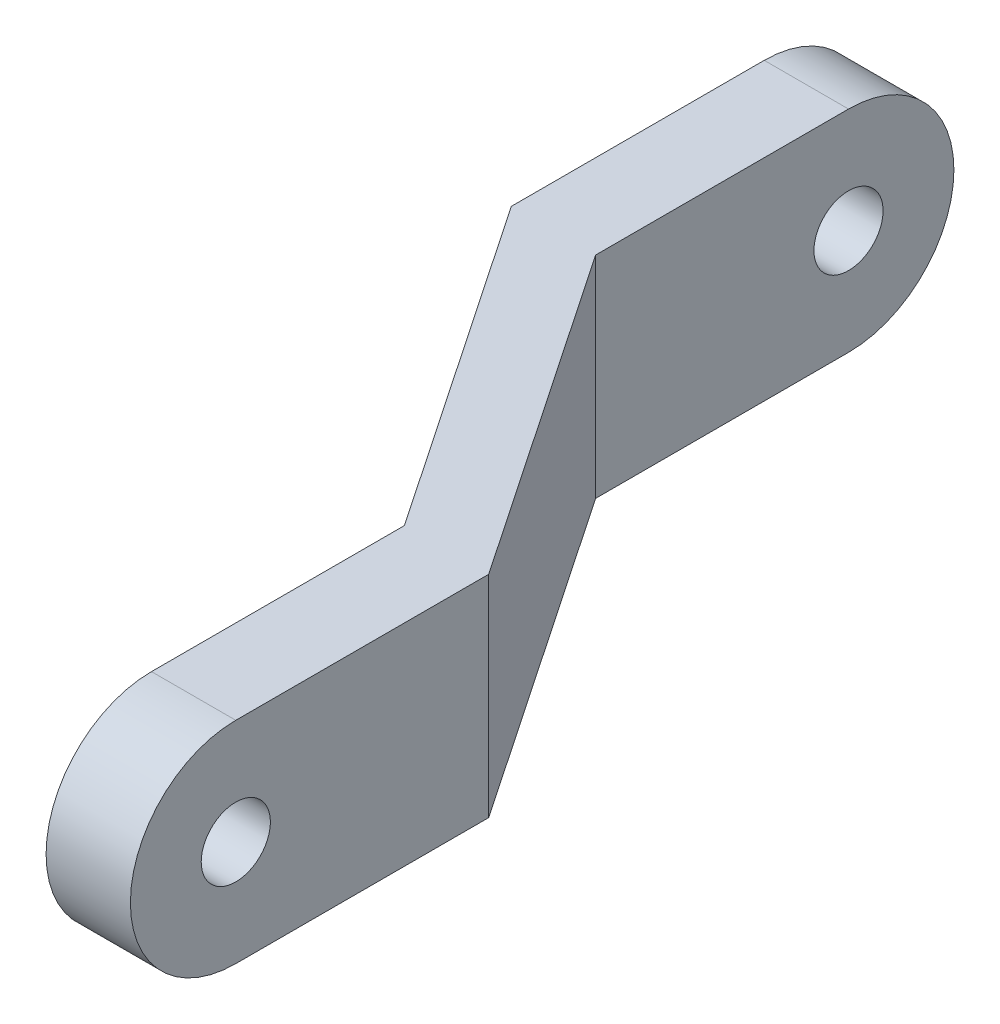
from build123d import *

# Parameters (mm, degrees)
BOSS_EXTRUDE1_DEPTH = 6.35
SKETCH2_R           = 1.0414
CUT_EXTRUDE1_DEPTH  = 31.496215156
SKETCH3_R           = 1.0414
CUT_EXTRUDE2_DEPTH  = 30.82342263


with BuildPart() as part:
    # Sketch1 → Boss-Extrude1 (new body)
    with BuildSketch(Plane(origin=(0, 0, 0), x_dir=(1, 0, 0), z_dir=(0, 1, 0))):
        Polygon((-16.681663134, -25.179419289), (-16.681663134, -17.559419289), (-23.400364211, -7.62), (-23.400364211, 0), (-23.400364211, 3.175), (-25.940364211, 3.175), (-25.940364211, 0), (-25.940364211, -7.62), (-19.221663134, -17.559419289), (-19.221663134, -25.179419289), (-19.221663134, -28.354419289), (-16.681663134, -28.354419289), align=None)
    extrude(amount=BOSS_EXTRUDE1_DEPTH)

    # Sketch2 → Cut-Extrude1 (cut, through all)
    with BuildSketch(Plane.ZY.offset(25.940364211)):
        with BuildLine():
            ThreePointArc((-3.175, 3.175), (-2.24506403, 5.42006403), (0, 6.35))
            Line((0, 6.35), (-3.175, 6.35))
            Line((-3.175, 6.35), (-3.175, 3.175))
        make_face()
        with BuildLine():
            ThreePointArc((0, 0), (-2.24506403, 0.92993597), (-3.175, 3.175))
            Line((-3.175, 3.175), (-3.175, 0))
            Line((-3.175, 0), (0, 0))
        make_face()
        with Locations((0, 3.175)):
            Circle(SKETCH2_R)
    extrude(amount=-CUT_EXTRUDE1_DEPTH, mode=Mode.SUBTRACT)

    # Sketch3 → Cut-Extrude2 (cut, through all)
    with BuildSketch(Plane.ZY.offset(19.221663134)):
        with BuildLine():
            Line((28.354419289, 6.35), (25.179419289, 6.35))
            ThreePointArc((25.179419289, 6.35), (27.424483319, 5.42006403), (28.354419289, 3.175))
            Line((28.354419289, 3.175), (28.354419289, 6.35))
        make_face()
        with BuildLine():
            Line((28.354419289, 0), (28.354419289, 3.175))
            ThreePointArc((28.354419289, 3.175), (27.424483319, 0.92993597), (25.179419289, 0))
            Line((25.179419289, 0), (28.354419289, 0))
        make_face()
        with Locations((25.179419289, 3.175)):
            Circle(SKETCH3_R)
    extrude(amount=-CUT_EXTRUDE2_DEPTH, mode=Mode.SUBTRACT)


solid = part.part
